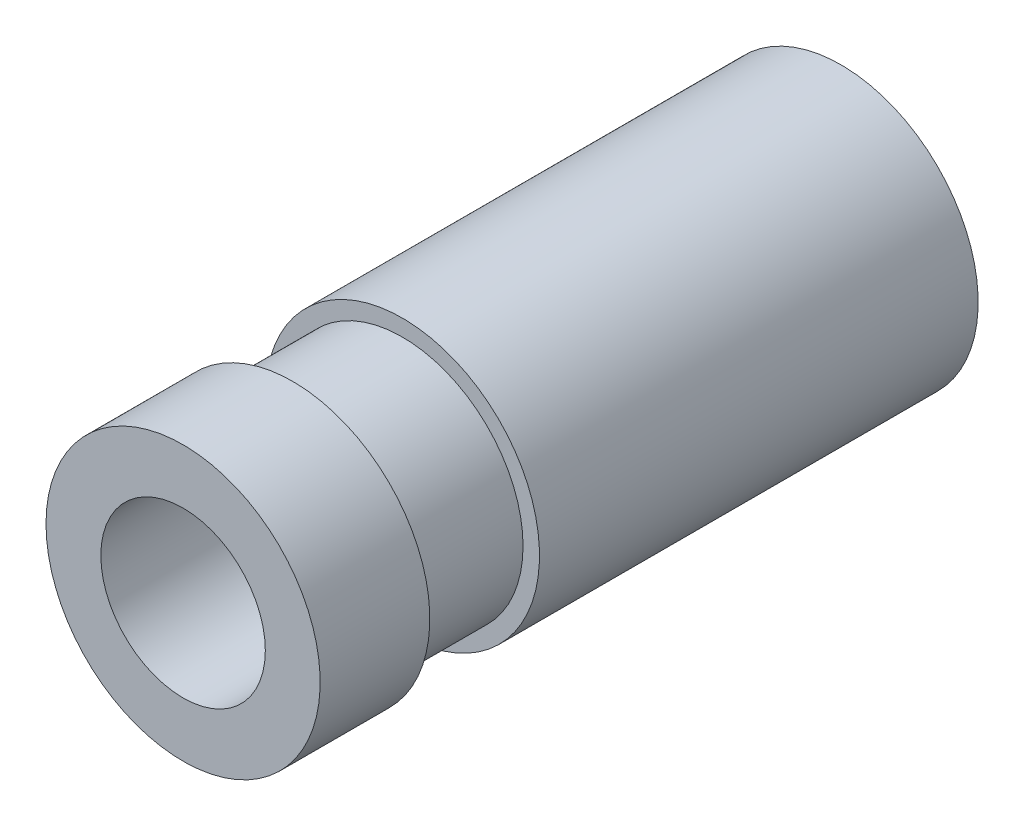
from build123d import *

# Parameters (mm, degrees)
SKETCH1_R           = 1.5875
SKETCH1_R_2         = 0.9525
BOSS_EXTRUDE1_DEPTH = 7.62
CUT_EXTRUDE1_START  = -1.27
SKETCH2_R           = 1.5875
SKETCH2_R_2         = 1.397
CUT_EXTRUDE1_DEPTH  = 1.27


with BuildPart() as part:
    # Sketch1 → Boss-Extrude1 (new body)
    with BuildSketch(Plane.XY):
        with Locations(Location((0, 0, 0), (0, 0, 180))):
            Circle(SKETCH1_R)
        with Locations(Location((0, 0, 0), (0, 0, 180))):
            Circle(SKETCH1_R_2, mode=Mode.SUBTRACT)
    extrude(amount=BOSS_EXTRUDE1_DEPTH)

    # Sketch2 → Cut-Extrude1 (cut)
    with BuildSketch(Plane.XY.offset(6.35).offset(CUT_EXTRUDE1_START)):
        with Locations(Location((0, 0, 0), (0, 0, 180))):
            Circle(SKETCH2_R)
        Circle(SKETCH2_R_2, mode=Mode.SUBTRACT)
    extrude(amount=CUT_EXTRUDE1_DEPTH, mode=Mode.SUBTRACT)


solid = part.part
